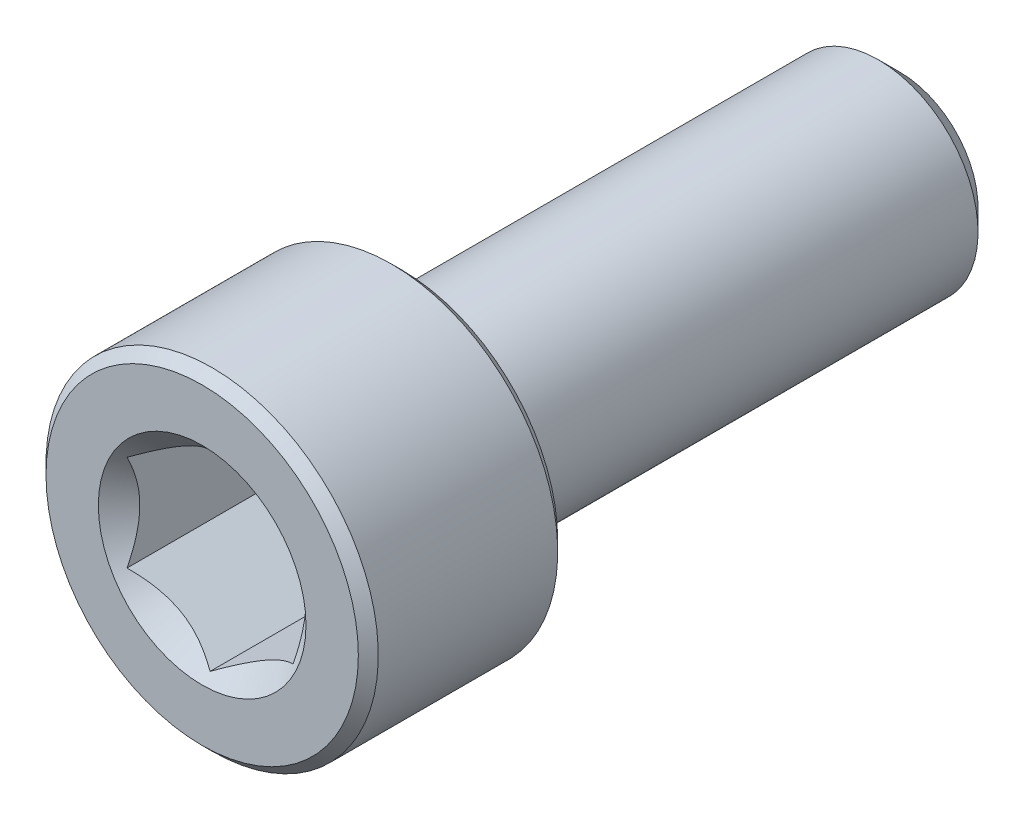
from build123d import *

# Parameters (mm, degrees)
CUT_EXTRUDE1_DEPTH = 5
SKETCH4_R          = 3.125
CUT_EXTRUDE2_DEPTH = 3
CUT_EXTRUDE2_DRAFT = -45


with BuildPart() as part:
    # Sketch2 → Revolve1 (revolve)
    with BuildSketch(Plane(origin=(0, 0, 0), x_dir=(0, 0, -1), z_dir=(1, 0, 0))):
        with BuildLine():
            Line((-10.5, 0), (-10.5, 4.7))
            Line((-10.5, 4.7), (-10.2, 5))
            Line((-10.2, 5), (-4.8, 5))
            Line((-4.8, 5), (-4.5, 4.7))
            Line((-4.5, 4.7), (-4.5, 3.3))
            ThreePointArc((-4.5, 3.3), (-4.412132034, 3.087867966), (-4.2, 3))
            Line((-4.2, 3), (9.850480947, 3))
            Line((9.850480947, 3), (10.5, 2.350480947))
            Line((10.5, 2.350480947), (10.5, 0))
            Line((10.5, 0), (-10.5, 0))
        make_face()
    revolve(axis=Axis((0, 0, -10.5), (0, 0, 1)))

    # Sketch3 → Cut-Extrude1 (cut)
    with BuildSketch(Plane.XY.offset(10.5)):
        Polygon((2.5, -1.443375673), (2.5, 1.443375673), (0, 2.886751346), (-2.5, 1.443375673), (-2.5, -1.443375673), (0, -2.886751346), align=None)
    extrude(amount=-CUT_EXTRUDE1_DEPTH, mode=Mode.SUBTRACT)


with BuildPart() as cut_extrude2_tool:
    # Sketch4 → Cut-Extrude2 (with draft: the straight prism first)
    with BuildSketch(Plane.XY.offset(10.5)):
        Circle(SKETCH4_R)
    extrude(amount=-CUT_EXTRUDE2_DEPTH)
    # Cut-Extrude2: the draft: its side faces are tilted about the plane it starts from
    cut_extrude2_sides = [cut_extrude2_tool.faces().sort_by_distance(p)[0] for p in [
        (-3.125, 0, 9),
    ]]
    draft(cut_extrude2_sides, Plane.XY.offset(10.5), CUT_EXTRUDE2_DRAFT)


with BuildPart() as part_1:
    add(part.part)

    # Cut-Extrude2: cut by cut_extrude2_tool
    add(cut_extrude2_tool.part, mode=Mode.SUBTRACT)


solid = part_1.part
